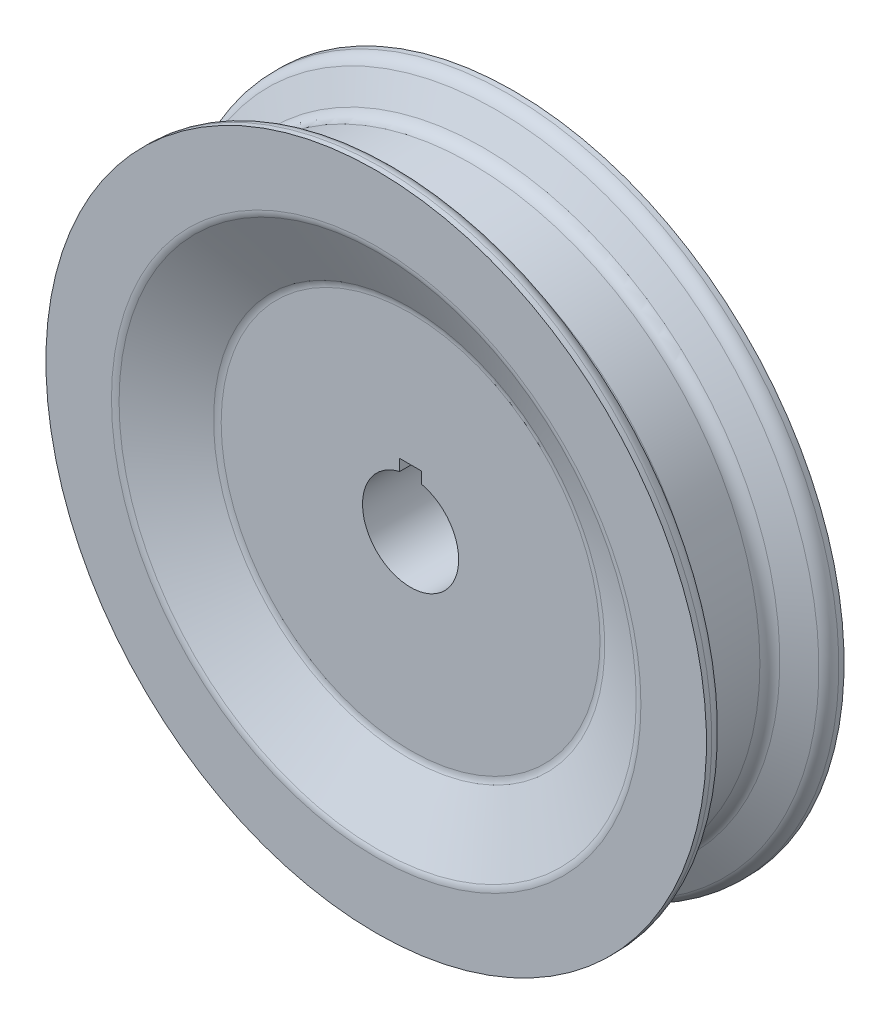
from build123d import *

# Parameters (mm, degrees)
FILLETS_R            = 5
SHAFT_CUT_DEPTH      = 174.799455871
SHAFT_CUT_DEPTH_BACK = 174.799455871


with BuildPart() as part:
    # Sketch1 → Main wheel extrude (revolve)
    with BuildSketch(Plane(origin=(0, 0, 0), x_dir=(0, 0, -1), z_dir=(1, 0, 0)), mode=Mode.PRIVATE) as main_wheel_extrude_sk:
        Polygon((-25, 120), (-25, 95), (-12.5, 70), (-12.5, 0), (12.5, 0), (12.5, 70), (25, 95), (25, 120), (20, 120), (12.5, 105), (-12.5, 105), (-20, 120), align=None)
    revolve(main_wheel_extrude_sk.sketch.rotate(Axis((0, 0, 12.5), (0, 0, -1)), 180), axis=Axis((0, 0, 12.5), (0, 0, -1)))

    # Fillets
    fillets_edges = [part.edges().sort_by_distance(p)[0] for p in [
        (0, 105, -12.5),
        (0, 120, -20),
        (0, 95, -25),
        (0, 70, -12.5),
        (0, 70, 12.5),
        (0, 95, 25),
        (0, 120, 20),
        (0, 105, 12.5),
    ]]
    fillet(fillets_edges, radius=FILLETS_R)

    # Sketch3 → Shaft cut (cut, two sides: drawn at the far end of the back side and taken through both)
    with BuildSketch(Plane(origin=(0, 0, -12.5), x_dir=(-1, 0, 0), z_dir=(0, 0, -1)).offset(-SHAFT_CUT_DEPTH_BACK)):
        with BuildLine():
            Line((-3.96875, 17.005526445), (-3.96875, 21.138106445))
            Line((-3.96875, 21.138106445), (3.96875, 21.138106445))
            Line((3.96875, 21.138106445), (3.96875, 17.005526445))
            ThreePointArc((3.96875, 17.005526445), (0, -17.4625), (-3.96875, 17.005526445))
        make_face()
    extrude(amount=SHAFT_CUT_DEPTH + SHAFT_CUT_DEPTH_BACK, mode=Mode.SUBTRACT)


solid = part.part
